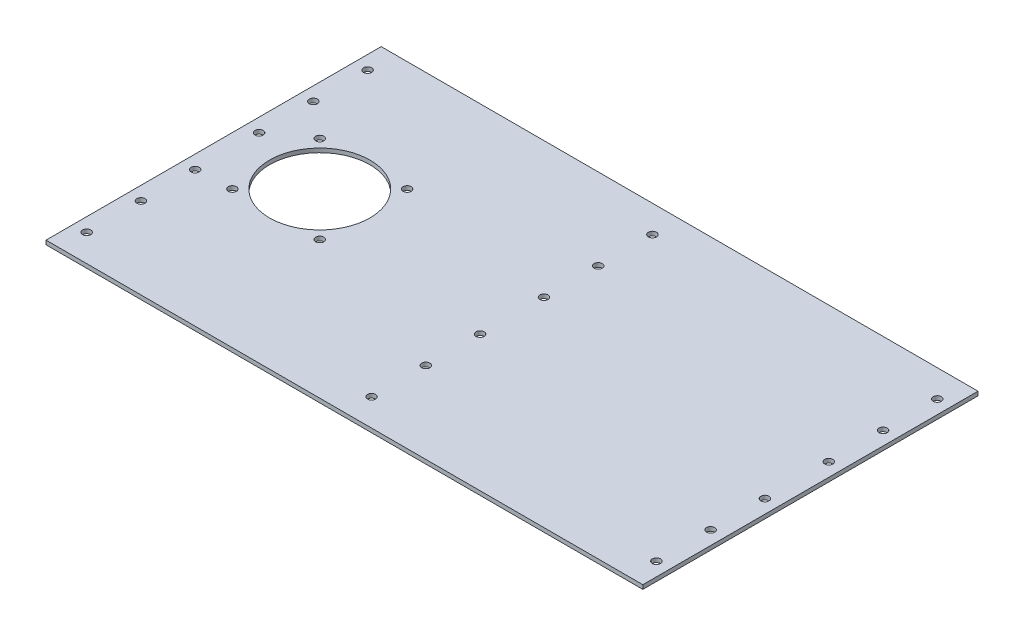
from build123d import *

# Parameters (mm, degrees)
SKETCH_1_W          = 220
SKETCH_1_H          = 123.55
EXTRUDE_1_DEPTH     = 1.5
SKETCH_2_R          = 18.5
SKETCH_2_R_2        = 1.5
CUT_EXTRUDE_1_DEPTH = 10


with BuildPart() as part:
    # 草图1 → 凸台-拉伸1 (new body)
    with BuildSketch(Plane(origin=(0, 0, 0), x_dir=(1, 0, 0), z_dir=(0, 1, 0))):
        with Locations((44.295012832, -17.457747405)):
            Rectangle(SKETCH_1_W, SKETCH_1_H)
    extrude(amount=EXTRUDE_1_DEPTH)

    # 草图2 → 切除-拉伸1 (cut)
    with BuildSketch(Plane(origin=(0, 1.5, 0), x_dir=(1, 0, 0), z_dir=(0, 1, 0))):
        with Locations(Location((-31.57031265, -12.457747405, 0), (0, 0, 270))):
            Circle(SKETCH_2_R)
        with Locations(Location((-47.67031265, 3.642252595, 0), (0, 0, 270))):
            Circle(SKETCH_2_R_2)
        with Locations(Location((-47.67031265, -28.557747405, 0), (0, 0, 270))):
            Circle(SKETCH_2_R_2)
        with Locations(Location((149.295012832, -69.232747405, 0), (0, 0, 270))):
            Circle(SKETCH_2_R_2)
        with Locations(Location((44.295012832, -69.232747405, 0), (0, 0, 270))):
            Circle(SKETCH_2_R_2)
        with Locations(Location((-60.704987168, -69.232747405, 0), (0, 0, 270))):
            Circle(SKETCH_2_R_2)
        with Locations(Location((44.295012832, -49.232747405, 0), (0, 0, 270))):
            Circle(SKETCH_2_R_2)
        with Locations(Location((-60.704987168, -49.232747405, 0), (0, 0, 270))):
            Circle(SKETCH_2_R_2)
        with Locations(Location((149.295012832, -49.232747405, 0), (0, 0, 270))):
            Circle(SKETCH_2_R_2)
        with Locations(Location((149.295012832, 14.317252595, 0), (0, 0, 270))):
            Circle(SKETCH_2_R_2)
        with Locations(Location((-60.704987168, 14.317252595, 0), (0, 0, 270))):
            Circle(SKETCH_2_R_2)
        with Locations(Location((44.295012832, 14.317252595, 0), (0, 0, 270))):
            Circle(SKETCH_2_R_2)
        with Locations(Location((-60.704987168, 34.317252595, 0), (0, 0, 270))):
            Circle(SKETCH_2_R_2)
        with Locations(Location((44.295012832, 34.317252595, 0), (0, 0, 270))):
            Circle(SKETCH_2_R_2)
        with Locations(Location((149.295012832, 34.317252595, 0), (0, 0, 270))):
            Circle(SKETCH_2_R_2)
        with Locations(Location((149.295012832, -29.232747405, 0), (0, 0, 270))):
            Circle(SKETCH_2_R_2)
        with Locations(Location((44.295012832, -29.232747405, 0), (0, 0, 270))):
            Circle(SKETCH_2_R_2)
        with Locations(Location((-60.704987168, -29.232747405, 0), (0, 0, 270))):
            Circle(SKETCH_2_R_2)
        with Locations(Location((149.295012832, -5.682747405, 0), (0, 0, 270))):
            Circle(SKETCH_2_R_2)
        with Locations(Location((44.295012832, -5.682747405, 0), (0, 0, 270))):
            Circle(SKETCH_2_R_2)
        with Locations(Location((-60.704987168, -5.682747405, 0), (0, 0, 270))):
            Circle(SKETCH_2_R_2)
        with Locations(Location((-15.47031265, 3.642252595, 0), (0, 0, 270))):
            Circle(SKETCH_2_R_2)
        with Locations(Location((-15.47031265, -28.557747405, 0), (0, 0, 270))):
            Circle(SKETCH_2_R_2)
    extrude(amount=-CUT_EXTRUDE_1_DEPTH, mode=Mode.SUBTRACT)


solid = part.part
